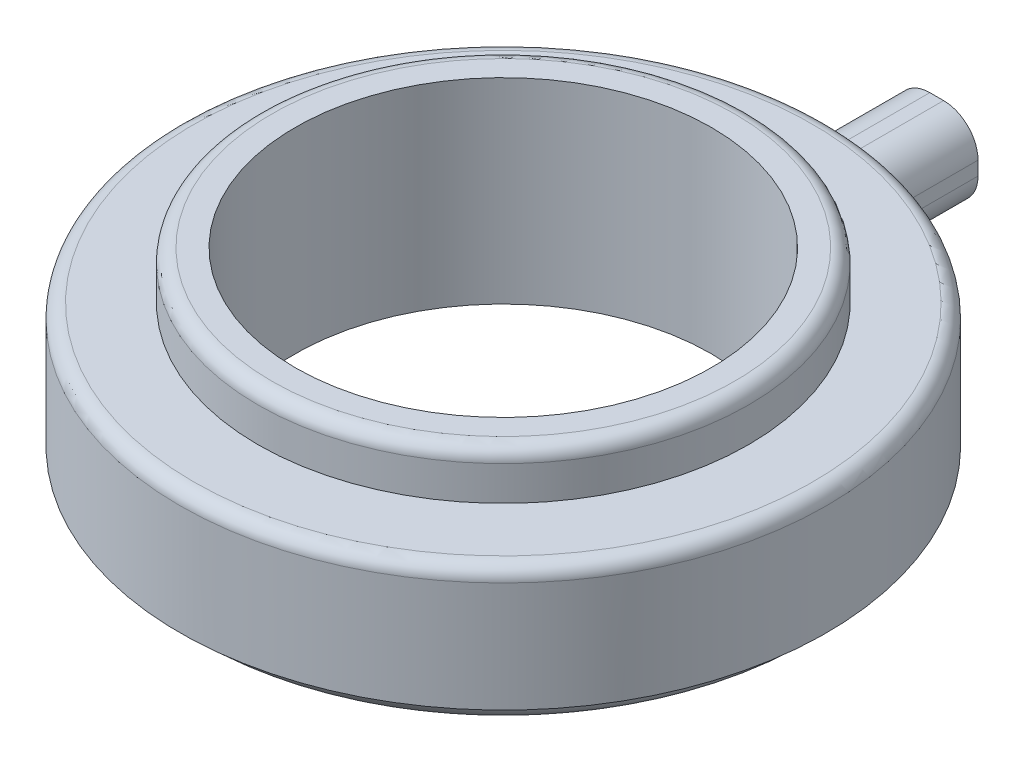
from build123d import *

# Parameters (mm, degrees)
SKETCH_1_R           = 47
EXTRUDE_1_DEPTH      = 21.5
SKETCH_2_R           = 35.65
EXTRUDE_2_DEPTH      = 7
SKETCH_3_R           = 30.25
CUT_EXTRUDE_1_DEPTH  = 73.320467366
FILLET_1_R           = 2
EXTRUDE_3_DEPTH      = 6
EXTRUDE_3_DEPTH_BACK = 6
SKETCH_4_W           = 103.611126825
SKETCH_4_H           = 12
CUT_EXTRUDE_3_DEPTH  = 81.212218521
FILLET_2_R           = 5
SKETCH_5_R           = 3.75
CUT_EXTRUDE_2_DEPTH  = 6
SKETCH_7_R           = 47
SKETCH_7_R_2         = 45
CUT_EXTRUDE_4_DEPTH  = 3.5
FILLET_3_R           = 3


with BuildPart() as part:
    # 草图1 → 凸台-拉伸1 (new body)
    with BuildSketch(Plane(origin=(0, 0, 0), x_dir=(1, 0, 0), z_dir=(0, 1, 0))):
        Circle(SKETCH_1_R)
    extrude(amount=EXTRUDE_1_DEPTH)

    # 草图2 → 凸台-拉伸2 (add)
    with BuildSketch(Plane(origin=(0, 21.5, 0), x_dir=(1, 0, 0), z_dir=(0, 1, 0))):
        Circle(SKETCH_2_R)
    extrude(amount=EXTRUDE_2_DEPTH)

    # 草图3 → 切除-拉伸1 (cut, through all)
    with BuildSketch(Plane(origin=(0, 28.5, 0), x_dir=(1, 0, 0), z_dir=(0, 1, 0))):
        Circle(SKETCH_3_R)
    extrude(amount=-CUT_EXTRUDE_1_DEPTH, mode=Mode.SUBTRACT)

    # 圆角1
    fillet_1_edges = [part.edges().sort_by_distance(p)[0] for p in [
        (-35.65, 28.5, 0),
        (-47, 21.5, 0),
    ]]
    fillet(fillet_1_edges, radius=FILLET_1_R)

    # 草图4 → 凸台-拉伸3 (add, two sides: drawn at the far end of the back side and taken through both)
    with BuildSketch(Plane(origin=(0, 0, 0), x_dir=(0, 0, -1), z_dir=(1, 0, 0)).offset(-EXTRUDE_3_DEPTH_BACK)):
        with Locations((11.194436588, 10)):
            Rectangle(SKETCH_4_W, SKETCH_4_H)
    extrude(amount=EXTRUDE_3_DEPTH + EXTRUDE_3_DEPTH_BACK)

    # 草图6 → 切除-拉伸3 (cut, through all)
    with BuildSketch(Plane(origin=(0, 16, 0), x_dir=(1, 0, 0), z_dir=(0, 1, 0))):
        with BuildLine():
            Line((-6, 29.648988178), (-6, -29.648988178))
            ThreePointArc((-6, -29.648988178), (0, -30.25), (6, -29.648988178))
            Line((6, -29.648988178), (6, 29.648988178))
            ThreePointArc((6, 29.648988178), (0, 30.25), (-6, 29.648988178))
        make_face()
    extrude(amount=-CUT_EXTRUDE_3_DEPTH, mode=Mode.SUBTRACT)

    # 圆角2
    fillet_2_edges = [part.edges().sort_by_distance(p)[0] for p in [
        (-6, 16, -54.807724042),
        (-6, 4, -54.807724042),
        (6, 4, -54.807724042),
        (6, 16, -54.807724042),
    ]]
    fillet(fillet_2_edges, radius=FILLET_2_R)

    # 草图5 → 切除-拉伸2 (cut)
    with BuildSketch(Plane(origin=(0, 0, -63), x_dir=(-1, 0, 0), z_dir=(0, 0, -1))):
        with Locations((0, 10)):
            Circle(SKETCH_5_R)
    extrude(amount=-CUT_EXTRUDE_2_DEPTH, mode=Mode.SUBTRACT)

    # 草图7 → 切除-拉伸4 (cut)
    with BuildSketch(Plane.XZ):
        Circle(SKETCH_7_R)
        Circle(SKETCH_7_R_2, mode=Mode.SUBTRACT)
    extrude(amount=-CUT_EXTRUDE_4_DEPTH, mode=Mode.SUBTRACT)

    # 圆角3
    fillet_3_edges = [part.edges().sort_by_distance(p)[0] for p in [
        (-45, 0, 0),
    ]]
    fillet(fillet_3_edges, radius=FILLET_3_R)


solid = part.part
